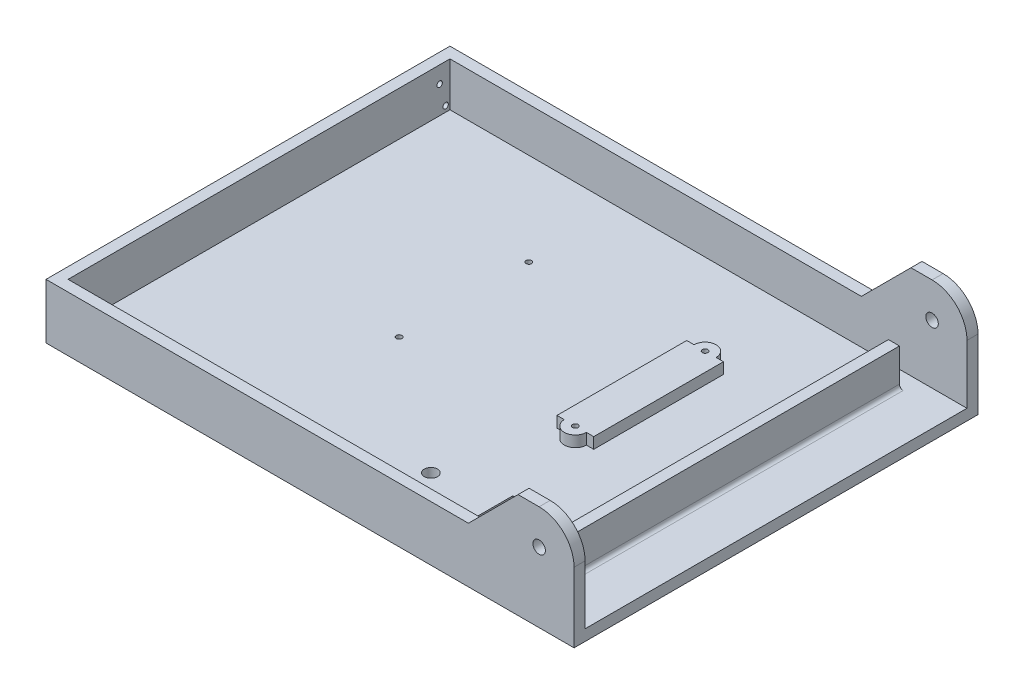
from build123d import *

# Parameters (mm, degrees)
EXTRUDE_1_DEPTH             = 103.907768917
SHELL_1_T                   = 3
HOLE_WIZARD_M3_1_D          = 3.4
SKETCH_6_W                  = 3
SKETCH_6_H                  = 95.907768917
EXTRUDE_2_DEPTH             = 10
SKETCH_10_R                 = 3
SKETCH_10_W                 = 10
SKETCH_10_H                 = 35.3
EXTRUDE_3_DEPTH             = 3
HOLE_WIZARD_M2_2_D          = 1.5
HOLE_WIZARD_M2_3_D          = 1.5
SKETCH_17_R                 = 1.8
SKETCH_17_R_2               = 0.75
SKETCH_17_W                 = 7.6
SKETCH_17_H                 = 10.2
CUT_EXTRUDE_1_DEPTH         = 3
FILLET_1_R                  = 1
TAP_DRILL_FOR_M2_TAP1_D     = 1.5
TAP_DRILL_FOR_M2_TAP1_DEPTH = 3


with BuildPart() as part:
    # 草图1 → 凸台-拉伸1 (new body)
    with BuildSketch(Plane.XY):
        with BuildLine():
            Line((113.912965174, -22.401534746), (113.912965174, -6.401534746))
            ThreePointArc((113.912965174, -6.401534746), (111.130479595, 0.315979676), (104.412965174, 3.098465254))
            Line((104.412965174, 3.098465254), (98.673756893, 3.098465254))
            Line((98.673756893, 3.098465254), (85.173756893, -10.401534746))
            Line((85.173756893, -10.401534746), (-26.759170781, -10.401534746))
            Line((-26.759170781, -10.401534746), (-26.759170781, -22.401534746))
            Line((-26.759170781, -22.401534746), (113.912965174, -22.401534746))
        make_face()
    extrude(amount=-EXTRUDE_1_DEPTH)

    # 抽壳1
    shell_1_openings = [part.faces().sort_by_distance(p)[0] for p in [
        (113.912965174, -14.401534746, -51.953884458),
        (111.130479595, 0.315979676, -51.953884458),
        (101.543361033, 3.098465254, -51.953884458),
        (91.923756893, -3.651534746, -51.953884458),
        (29.207293056, -10.401534746, -51.953884458),
    ]]
    offset(amount=SHELL_1_T, openings=shell_1_openings, kind=Kind.INTERSECTION)

    # M3 间隙孔1 (through all)
    with Locations(Plane.XY.offset(3)):
        with Locations((104.412965174, -6.401534746)):
            Hole(HOLE_WIZARD_M3_1_D / 2)

    # 草图6 → 凸台-拉伸2 (add)
    with BuildSketch(Plane(origin=(0, -22.401534746, 0), x_dir=(1, 0, 0), z_dir=(0, 1, 0))):
        with Locations((98.543945955, 51.453884459)):
            Rectangle(SKETCH_6_W, SKETCH_6_H)
    extrude(amount=EXTRUDE_2_DEPTH)

    # 草图10 → 凸台-拉伸3 (add)
    with BuildSketch(Plane(origin=(0, -22.401534746, 0), x_dir=(1, 0, 0), z_dir=(0, 1, 0))):
        with Locations((67.811261753, 78.757768917)):
            Circle(SKETCH_10_R)
        with Locations((67.811261753, 43.457768917)):
            Circle(SKETCH_10_R)
        with Locations((67.811261753, 61.107768917)):
            Rectangle(SKETCH_10_W, SKETCH_10_H)
        with BuildLine():
            ThreePointArc((64.811261753, 43.457768917), (67.811261753, 40.457768917), (70.811261753, 43.457768917))
            Line((70.811261753, 43.457768917), (64.811261753, 43.457768917))
        make_face()
        with BuildLine():
            Line((64.811261753, 43.457768917), (70.811261753, 43.457768917))
            ThreePointArc((70.811261753, 43.457768917), (67.811261753, 46.457768917), (64.811261753, 43.457768917))
        make_face()
        with BuildLine():
            ThreePointArc((64.811261753, 78.757768917), (67.811261753, 75.757768917), (70.811261753, 78.757768917))
            Line((70.811261753, 78.757768917), (64.811261753, 78.757768917))
        make_face()
        with BuildLine():
            Line((64.811261753, 78.757768917), (70.811261753, 78.757768917))
            ThreePointArc((70.811261753, 78.757768917), (67.811261753, 81.757768917), (64.811261753, 78.757768917))
        make_face()
    extrude(amount=EXTRUDE_3_DEPTH)

    # M2 螺纹孔的螺纹孔钻头2 (through all)
    with Locations(Plane(origin=(0, -19.401534746, 0), x_dir=(1, 0, 0), z_dir=(0, 1, 0))):
        with Locations((67.811261753, 43.457768917), (67.811261753, 78.757768917)):
            Hole(HOLE_WIZARD_M2_2_D / 2)

    # M2 螺纹孔的螺纹孔钻头3 (through all)
    with Locations(Plane(origin=(0, -22.401534746, 0), x_dir=(1, 0, 0), z_dir=(0, 1, 0))):
        with Locations((19.856566152, 43.457768917), (19.856566152, 78.757768917)):
            Hole(HOLE_WIZARD_M2_3_D / 2)

    # 草图17 → 切除-拉伸1 (cut)
    with BuildSketch(Plane.XZ.offset(25.401534746)):
        with Locations((56.1974918, -15.765719737)):
            Circle(SKETCH_17_R)
        with Locations((81.7174918, -23.765719737)):
            Circle(SKETCH_17_R_2)
        with Locations((76.5474918, -16.415719737)):
            Rectangle(SKETCH_17_W, SKETCH_17_H)
    extrude(amount=-CUT_EXTRUDE_1_DEPTH, mode=Mode.SUBTRACT)

    # 圆角1
    fillet_1_edges = [part.edges().sort_by_distance(p)[0] for p in [
        (100.043945955, -22.401534746, -51.453884458),
    ]]
    fillet(fillet_1_edges, radius=FILLET_1_R)

    # Tap Drill for M2 Tap1
    with Locations(Plane.ZY.offset(29.759170781)):
        with Locations((-2.818814719, -20.846782883), (-1.181185281, -14.956286608), (-102.726583636, -20.846782883), (-101.088954197, -14.956286608)):
            Hole(TAP_DRILL_FOR_M2_TAP1_D / 2, depth=TAP_DRILL_FOR_M2_TAP1_DEPTH)


solid = part.part
